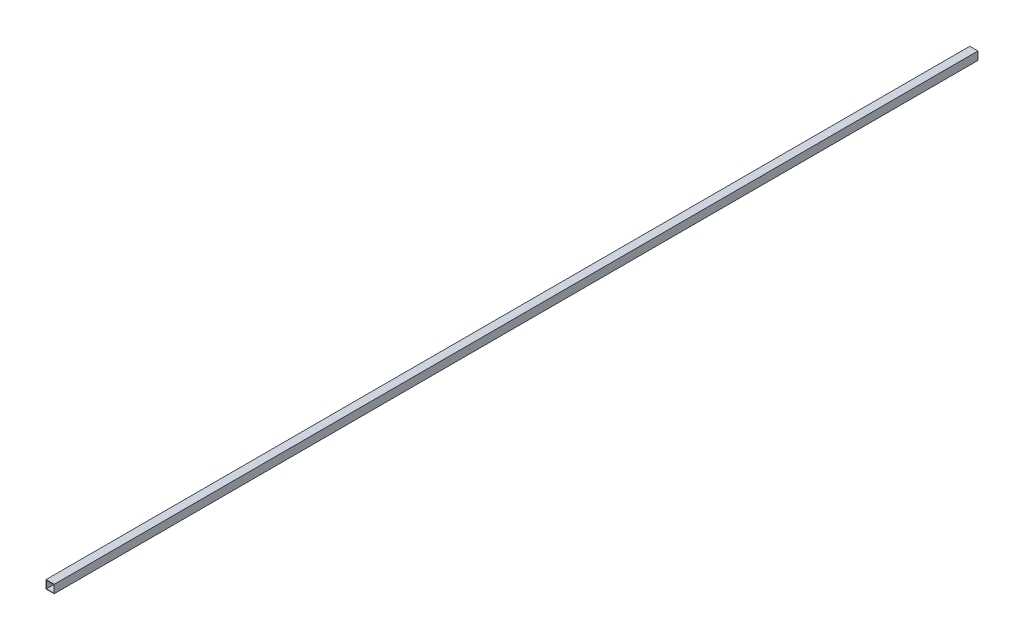
from build123d import *

# Parameters (mm, degrees)
SKETCH_1_W      = 20
SKETCH_1_H      = 20
SKETCH_1_W_2    = 18
SKETCH_1_H_2    = 18
EXTRUDE_1_DEPTH = 2250


with BuildPart() as part:
    # 草图1 → 凸台-拉伸1 (new body)
    with BuildSketch(Plane.XY):
        with Locations((10, 10)):
            Rectangle(SKETCH_1_W, SKETCH_1_H)
        with Locations((10, 10)):
            Rectangle(SKETCH_1_W_2, SKETCH_1_H_2, mode=Mode.SUBTRACT)
    extrude(amount=EXTRUDE_1_DEPTH)


solid = part.part
